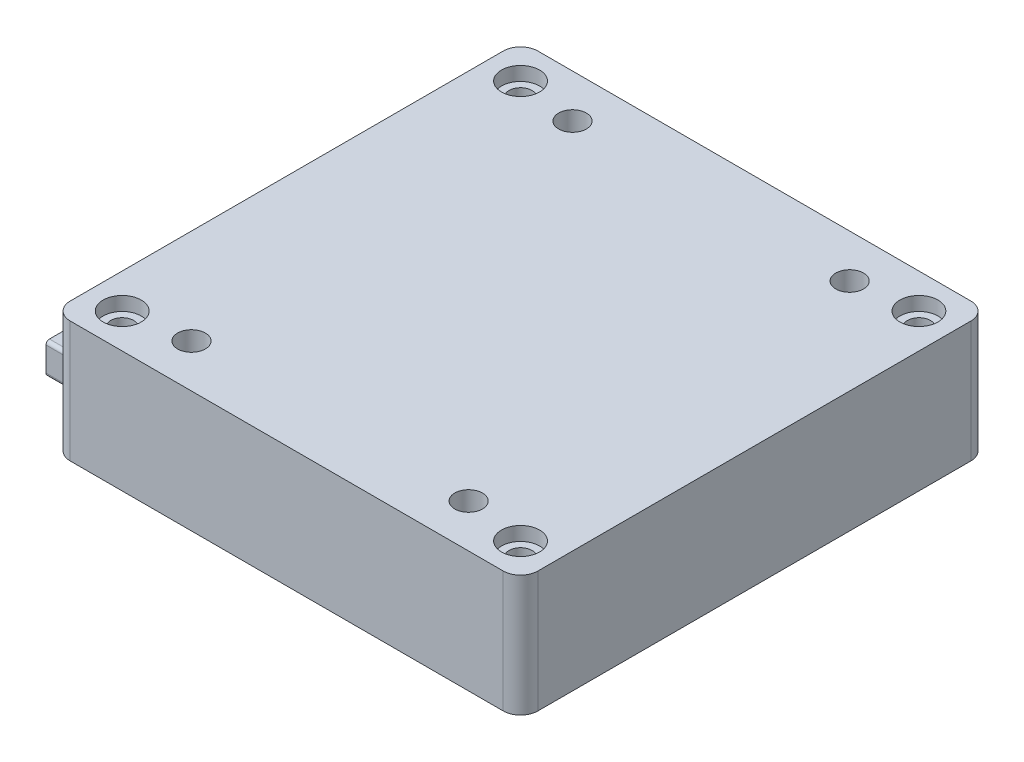
from build123d import *

# Parameters (mm, degrees)
SKETCH2_W               = 135
SKETCH2_H               = 135
BOSS_EXTRUDE1_DEPTH     = 35
FILLET1_R               = 5
SKETCH7_W               = 120
SKETCH7_H               = 14
BOSS_EXTRUDE2_DEPTH     = 2
FILLET2_R               = 2
SKETCH9_W               = 113
SKETCH9_H               = 7
BOSS_EXTRUDE3_DEPTH     = 10
SKETCH12_R              = 4
CUT_EXTRUDE1_DEPTH      = 10
MIRROR4_COPY_2_SKETCH_R = 4
MIRROR4_COPY_2_DEPTH    = 10
MIRROR4_COPY_4_SKETCH_R = 4
MIRROR4_COPY_4_DEPTH    = 10


with BuildPart() as part:
    # Sketch2 → Boss-Extrude1 (new body)
    with BuildSketch(Plane(origin=(0, 0, 0), x_dir=(1, 0, 0), z_dir=(0, 1, 0))):
        Rectangle(SKETCH2_W, SKETCH2_H)
    extrude(amount=BOSS_EXTRUDE1_DEPTH)

    # Fillet1
    fillet1_edges = [part.edges().sort_by_distance(p)[0] for p in [
        (67.5, 17.5, -67.5),
        (67.5, 17.5, 67.5),
        (-67.5, 17.5, 67.5),
        (-67.5, 17.5, -67.5),
    ]]
    fillet(fillet1_edges, radius=FILLET1_R)

    # Sketch6 → CBORE for M6 Hex Head Bolt1 (revolve, cut)
    with BuildSketch(Plane(origin=(-57.5, 35, -57.5), x_dir=(0, 0, 1), z_dir=(1, 0, 0))):
        Polygon((0, 0), (0, 43.982840043), (3.3, 42), (3.3, 4), (5.5, 4), (5.5, 0), align=None)
    cbore_for_m6_hex_head_bolt1 = revolve(axis=Axis((-57.5, 41.35, -57.5), (0, -1, 0)), mode=Mode.SUBTRACT)

    # Sketch12 → Cut-Extrude1 (cut)
    with BuildSketch(Plane(origin=(0, 35, 0), x_dir=(1, 0, 0), z_dir=(0, 1, 0))):
        with Locations((-40, 55)):
            Circle(SKETCH12_R)
    cut_extrude1 = extrude(amount=-CUT_EXTRUDE1_DEPTH, mode=Mode.SUBTRACT)

    # Mirror3: CBORE for M6 Hex Head Bolt1, Cut-Extrude1 across plane
    add(cbore_for_m6_hex_head_bolt1.mirror(Plane.XY), mode=Mode.SUBTRACT)
    add(cut_extrude1.mirror(Plane.XY), mode=Mode.SUBTRACT)

    # Mirror4 copy 1 sketch → Mirror4 copy 1 (revolve, cut)
    with BuildSketch(Plane(origin=(57.5, 35, 57.5), x_dir=(0, 0, -1), z_dir=(-1, 0, 0))):
        Polygon((0, 0), (0, 43.982840043), (3.3, 42), (3.3, 4), (5.5, 4), (5.5, 0), align=None)
    revolve(axis=Axis((57.5, 41.35, 57.5), (0, -1, 0)), mode=Mode.SUBTRACT)

    # Mirror4 copy 2 sketch → Mirror4 copy 2 (cut)
    with BuildSketch(Plane(origin=(0, 35, 0), x_dir=(-1, 0, 0), z_dir=(0, 1, 0))):
        with Locations((-40, 55)):
            Circle(MIRROR4_COPY_2_SKETCH_R)
    extrude(amount=-MIRROR4_COPY_2_DEPTH, mode=Mode.SUBTRACT)

    # Mirror4 copy 3 sketch → Mirror4 copy 3 (revolve, cut)
    with BuildSketch(Plane(origin=(57.5, 35, -57.5), x_dir=(0, 0, 1), z_dir=(-1, 0, 0))):
        Polygon((0, 0), (0, -43.982840043), (3.3, -42), (3.3, -4), (5.5, -4), (5.5, 0), align=None)
    revolve(axis=Axis((57.5, 41.35, -57.5), (0, 1, 0)), mode=Mode.SUBTRACT)

    # Mirror4 copy 4 sketch → Mirror4 copy 4 (cut)
    with BuildSketch(Plane(origin=(0, 35, 0), x_dir=(-1, 0, 0), z_dir=(0, 1, 0))):
        with Locations((-40, -55)):
            Circle(MIRROR4_COPY_4_SKETCH_R)
    extrude(amount=-MIRROR4_COPY_4_DEPTH, mode=Mode.SUBTRACT)


with BuildPart() as body_2:
    # Sketch7 → Boss-Extrude2 (new body)
    with BuildSketch(Plane.ZY.offset(67.5)):
        with Locations((0, 12)):
            Rectangle(SKETCH7_W, SKETCH7_H)
    extrude(amount=BOSS_EXTRUDE2_DEPTH)

    # Fillet2
    fillet2_edges = [body_2.edges().sort_by_distance(p)[0] for p in [
        (-68.5, 5, -60),
        (-68.5, 5, 60),
        (-68.5, 19, 60),
        (-68.5, 19, -60),
    ]]
    fillet(fillet2_edges, radius=FILLET2_R)

    # Sketch9 → Boss-Extrude3 (add)
    with BuildSketch(Plane.ZY.offset(69.5)):
        with BuildLine():
            Line((56.5, 16.5), (-56.5, 16.5))
            ThreePointArc((-56.5, 16.5), (-57.207106781, 16.207106781), (-57.5, 15.5))
            Line((-57.5, 15.5), (-57.5, 8.5))
            ThreePointArc((-57.5, 8.5), (-57.207106781, 7.792893219), (-56.5, 7.5))
            Line((-56.5, 7.5), (56.5, 7.5))
            ThreePointArc((56.5, 7.5), (57.207106781, 7.792893219), (57.5, 8.5))
            Line((57.5, 8.5), (57.5, 15.5))
            ThreePointArc((57.5, 15.5), (57.207106781, 16.207106781), (56.5, 16.5))
        make_face()
        with Locations((0, 12)):
            Rectangle(SKETCH9_W, SKETCH9_H, mode=Mode.SUBTRACT)
    extrude(amount=BOSS_EXTRUDE3_DEPTH)


solid = Compound([part.part, body_2.part])
